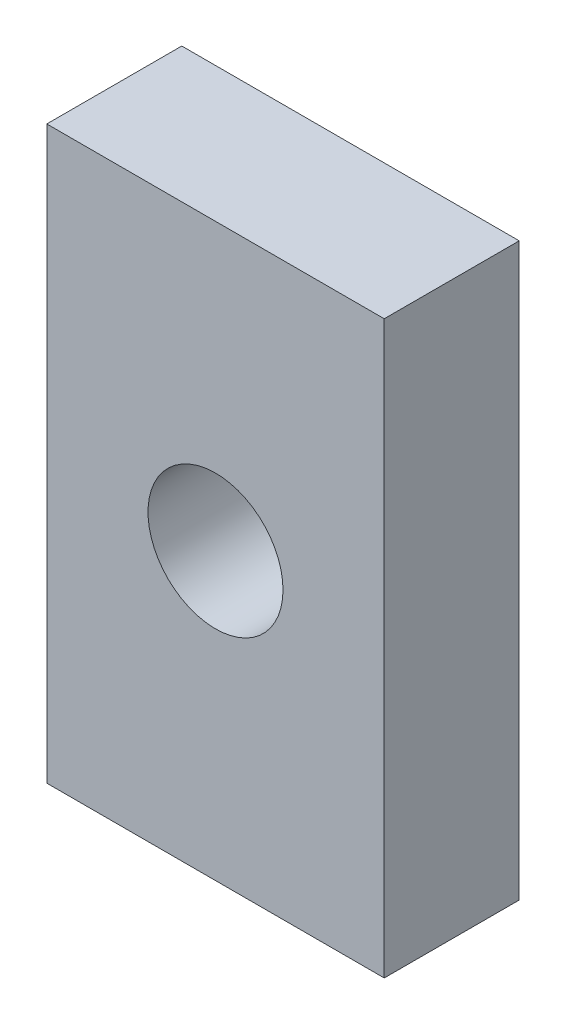
from build123d import *

# Parameters (mm, degrees)
SKETCH1_W           = 25
SKETCH1_H           = 42.3
SKETCH1_R           = 5
BOSS_EXTRUDE1_DEPTH = 10


with BuildPart() as part:
    # Sketch1 → Boss-Extrude1 (new body)
    with BuildSketch(Plane.XY):
        Rectangle(SKETCH1_W, SKETCH1_H)
        Circle(SKETCH1_R, mode=Mode.SUBTRACT)
    extrude(amount=BOSS_EXTRUDE1_DEPTH)


solid = part.part
